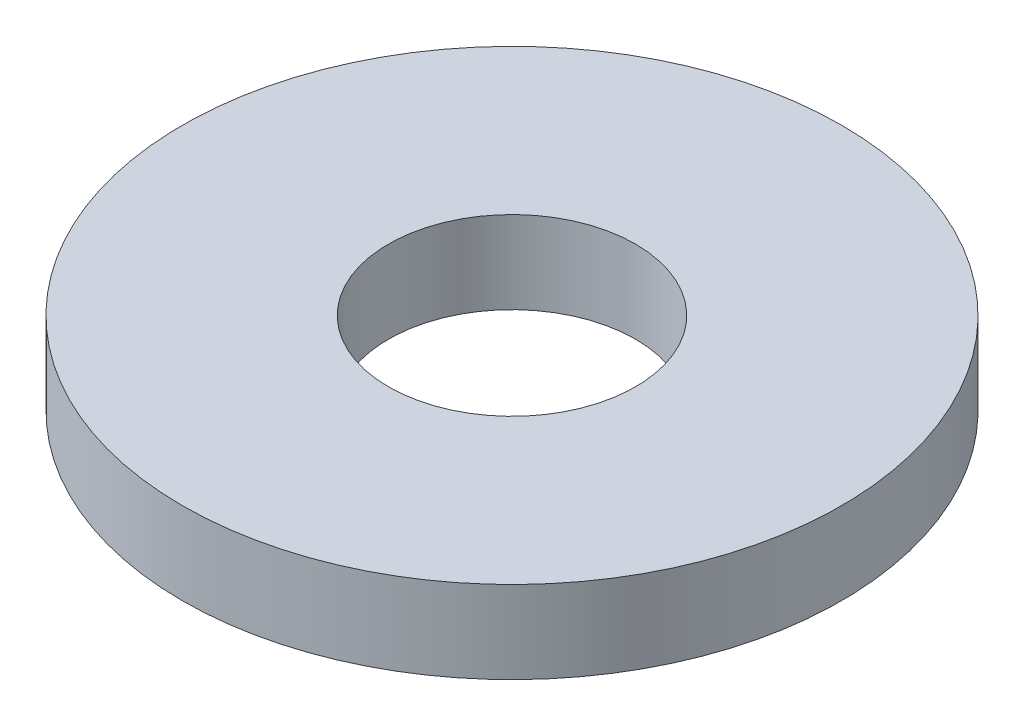
from build123d import *

# Parameters (mm, degrees)
SKETCH1_R           = 4
SKETCH1_R_2         = 1.5
BOSS_EXTRUDE1_DEPTH = 1


with BuildPart() as part:
    # Sketch1 → Boss-Extrude1 (new body)
    with BuildSketch(Plane(origin=(0, 0, 0), x_dir=(1, 0, 0), z_dir=(0, 1, 0))):
        with Locations(Location((0, 0, 0), (0, 0, 270))):
            Circle(SKETCH1_R)
        with Locations(Location((0, 0, 0), (0, 0, 270))):
            Circle(SKETCH1_R_2, mode=Mode.SUBTRACT)
    extrude(amount=BOSS_EXTRUDE1_DEPTH)


solid = part.part
